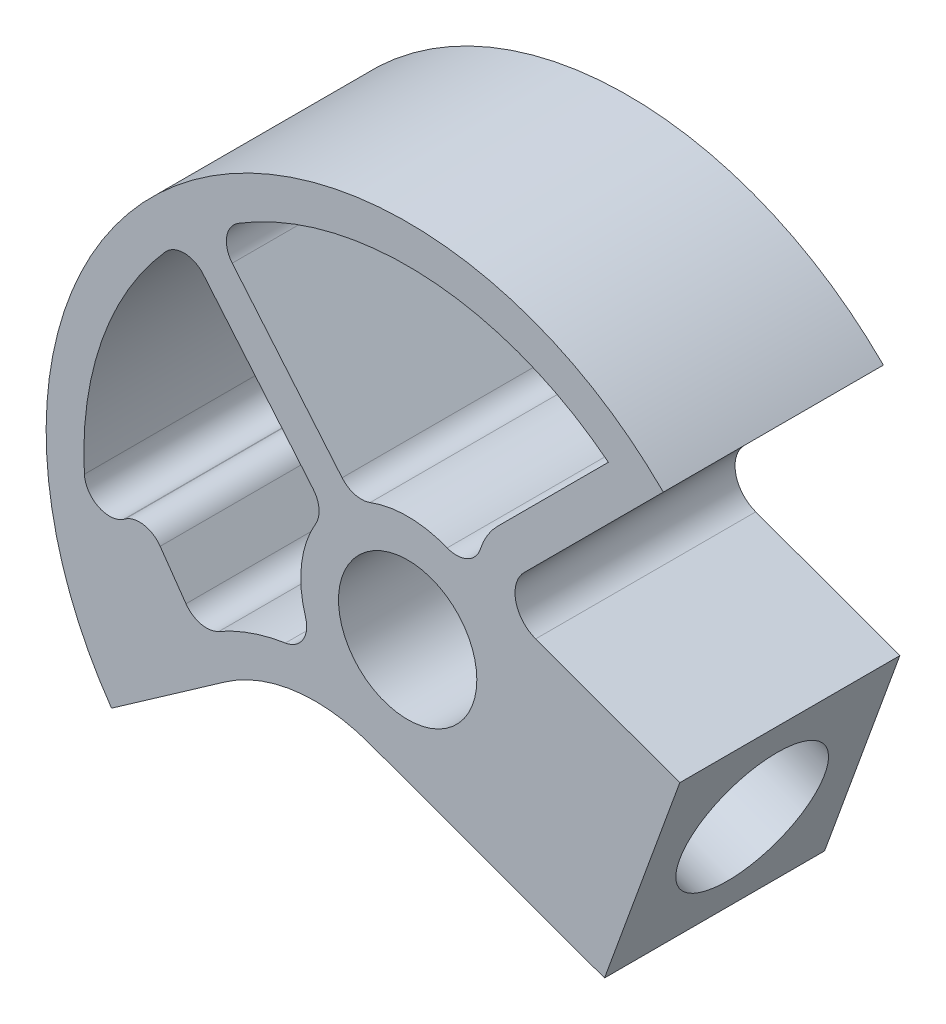
from build123d import *

# Parameters (mm, degrees)
SKETCH1_R           = 11
BOSS_EXTRUDE1_DEPTH = 35
FILLET2_R           = 25
FILLET5_R           = 5
CUT_EXTRUDE2_DEPTH  = 35
FILLET6_R           = 4
CUT_EXTRUDE1_DEPTH  = 20


with BuildPart() as part:
    # Sketch1 → Boss-Extrude1 (new body)
    with BuildSketch(Plane.XY):
        with BuildLine():
            Line((-47.101242547, -32.98064509), (-15.03971276, -10.530920247))
            ThreePointArc((-15.03971276, -10.530920247), (-11.176920202, -14.566045997), (-6.279523746, -17.252849698))
            Line((-6.279523746, -17.252849698), (31.308181085, -30.933655431))
            Line((31.308181085, -30.933655431), (43.278886102, 1.955586297))
            Line((43.278886102, 1.955586297), (12.982550619, 12.982550619))
            Line((12.982550619, 12.982550619), (40.658639918, 40.658639918))
            ThreePointArc((40.658639918, 40.658639918), (-36.960287557, 44.047555479), (-47.101242547, -32.98064509))
        make_face()
        Circle(SKETCH1_R, mode=Mode.SUBTRACT)
    extrude(amount=BOSS_EXTRUDE1_DEPTH)

    # Fillet2
    fillet2_edges = [part.edges().sort_by_distance(p)[0] for p in [
        (-15.03971276, -10.530920247, 17.5),
    ]]
    fillet(fillet2_edges, radius=FILLET2_R)

    # Fillet5
    fillet5_edges = [part.edges().sort_by_distance(p)[0] for p in [
        (12.982550619, 12.982550619, 17.5),
    ]]
    fillet(fillet5_edges, radius=FILLET5_R)

    # Sketch4 → Cut-Extrude2 (cut)
    with BuildSketch(Plane.XY.offset(35)):
        with BuildLine():
            Line((-41.656871027, -3.532188748), (-33.053224482, -15.819469412))
            Line((-33.053224482, -15.819469412), (-32.46214687, -15.405592412))
            ThreePointArc((-32.46214687, -15.405592412), (-23.62229066, -11.116679876), (-13.884259621, -9.809553241))
            ThreePointArc((-13.884259621, -9.809553241), (-16.986342471, 0.681299827), (-13.054027301, 10.890012453))
            Line((-13.054027301, 10.890012453), (-35.345481592, 37.455933189))
            ThreePointArc((-35.345481592, 37.455933189), (-49.017443505, 15.796842477), (-50.564853617, -9.769625307))
            Line((-50.564853617, -9.769625307), (-41.656871027, -3.532188748))
        make_face()
        with BuildLine():
            ThreePointArc((31.925370041, 40.410651415), (0.741106983, 51.494667301), (-30.749214933, 41.312658847))
            Line((-30.749214933, 41.312658847), (-8.457760642, 14.746738111))
            ThreePointArc((-8.457760642, 14.746738111), (1.75926732, 16.908724922), (11.312388901, 12.68975403))
            ThreePointArc((11.312388901, 12.68975403), (11.517857333, 18.111100205), (14.289586512, 22.774867886))
            Line((14.289586512, 22.774867886), (31.925370041, 40.410651415))
        make_face()
    extrude(amount=-CUT_EXTRUDE2_DEPTH, mode=Mode.SUBTRACT)

    # Fillet6
    fillet6_edges = [part.edges().sort_by_distance(p)[0] for p in [
        (-13.884259621, -9.809553241, 17.5),
        (-13.054027301, 10.890012453, 17.5),
        (-35.345481592, 37.455933189, 17.5),
        (-30.749214933, 41.312658847, 17.5),
        (-8.457760642, 14.746738111, 17.5),
        (11.312388901, 12.68975403, 17.5),
        (-50.564853617, -9.769625307, 17.5),
        (-33.053224482, -15.819469412, 17.5),
        (-41.656871027, -3.532188748, 17.5),
    ]]
    fillet(fillet6_edges, radius=FILLET6_R)

    # Sketch2 → Cut-Extrude1 (cut)
    with BuildSketch(Plane(origin=(37.587704831, -13.680805733, 0), x_dir=(0, 0, -1), z_dir=(0.939692620785907, -0.34202014332567265, 0))):
        with BuildLine():
            ThreePointArc((-6, -0.86009916), (-13.099140528, 9.764515464), (-25.631727984, 7.271628823))
            Line((-25.631727984, 7.271628823), (-9.368272016, -8.991827144))
            ThreePointArc((-9.368272016, -8.991827144), (-6.875385376, -5.260958632), (-6, -0.86009916))
        make_face()
        with BuildLine():
            Line((-9.368272016, -8.991827144), (-25.631727984, 7.271628823))
            ThreePointArc((-25.631727984, 7.271628823), (-25.631727984, -8.991827144), (-9.368272016, -8.991827144))
        make_face()
    extrude(amount=-CUT_EXTRUDE1_DEPTH, mode=Mode.SUBTRACT)


solid = part.part
